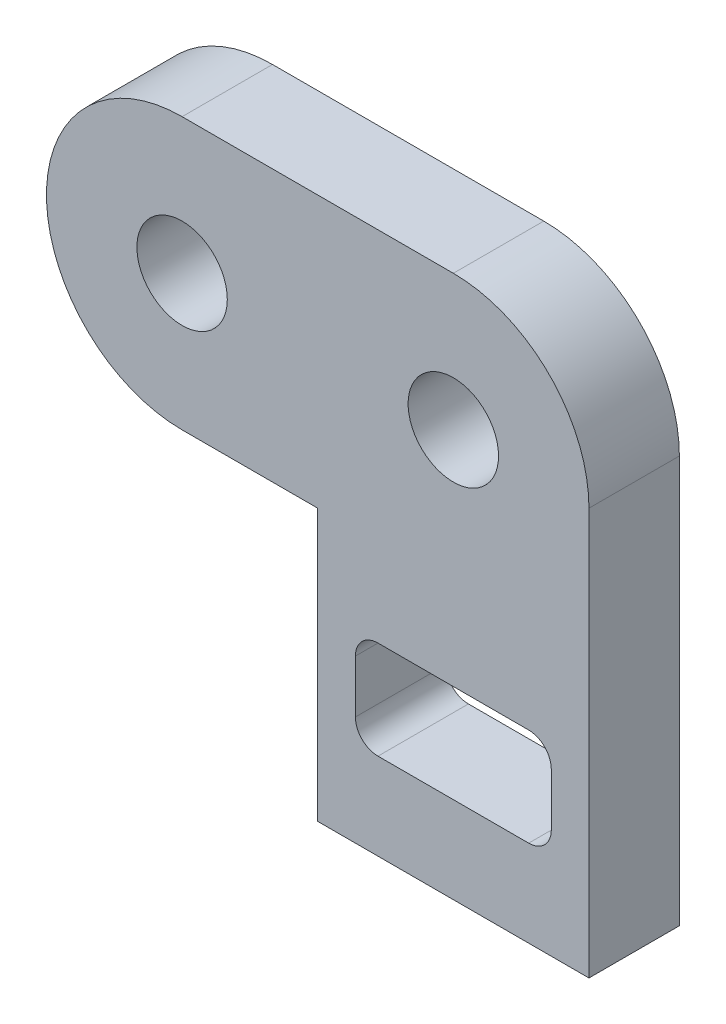
from build123d import *

# Parameters (mm, degrees)
MODEL_R                 = 1.5
SALIENTE_EXTRUIR1_DEPTH = 3


with BuildPart() as part:
    # Model → Saliente-Extruir1 (new body)
    with BuildSketch(Plane.XY):
        with BuildLine():
            Line((149.34213351, 211.823953209), (158.34213351, 211.823953209))
            ThreePointArc((158.34213351, 211.823953209), (161.524114025, 210.505933724), (162.84213351, 207.323953209))
            Line((162.84213351, 207.323953209), (162.84213351, 193.823953209))
            Line((162.84213351, 193.823953209), (153.84213351, 193.823953209))
            Line((153.84213351, 193.823953209), (153.84213351, 202.823953209))
            Line((153.84213351, 202.823953209), (149.34213351, 202.823953209))
            ThreePointArc((149.34213351, 202.823953209), (144.84213351, 207.323953209), (149.34213351, 211.823953209))
        make_face()
        with Locations((149.34213351, 207.323953209)):
            Circle(MODEL_R, mode=Mode.SUBTRACT)
        with Locations((158.34213351, 207.323953209)):
            Circle(MODEL_R, mode=Mode.SUBTRACT)
        with BuildLine():
            Line((160.84213351, 196.698953209), (155.84213351, 196.698953209))
            ThreePointArc((155.84213351, 196.698953209), (155.311803424, 196.918623123), (155.09213351, 197.448953209))
            Line((155.09213351, 197.448953209), (155.09213351, 199.198953209))
            ThreePointArc((155.09213351, 199.198953209), (155.311803424, 199.729283295), (155.84213351, 199.948953209))
            Line((155.84213351, 199.948953209), (160.84213351, 199.948953209))
            ThreePointArc((160.84213351, 199.948953209), (161.372463595, 199.729283295), (161.59213351, 199.198953209))
            Line((161.59213351, 199.198953209), (161.59213351, 197.448953209))
            ThreePointArc((161.59213351, 197.448953209), (161.372463595, 196.918623123), (160.84213351, 196.698953209))
        make_face(mode=Mode.SUBTRACT)
    extrude(amount=SALIENTE_EXTRUIR1_DEPTH)


solid = part.part
